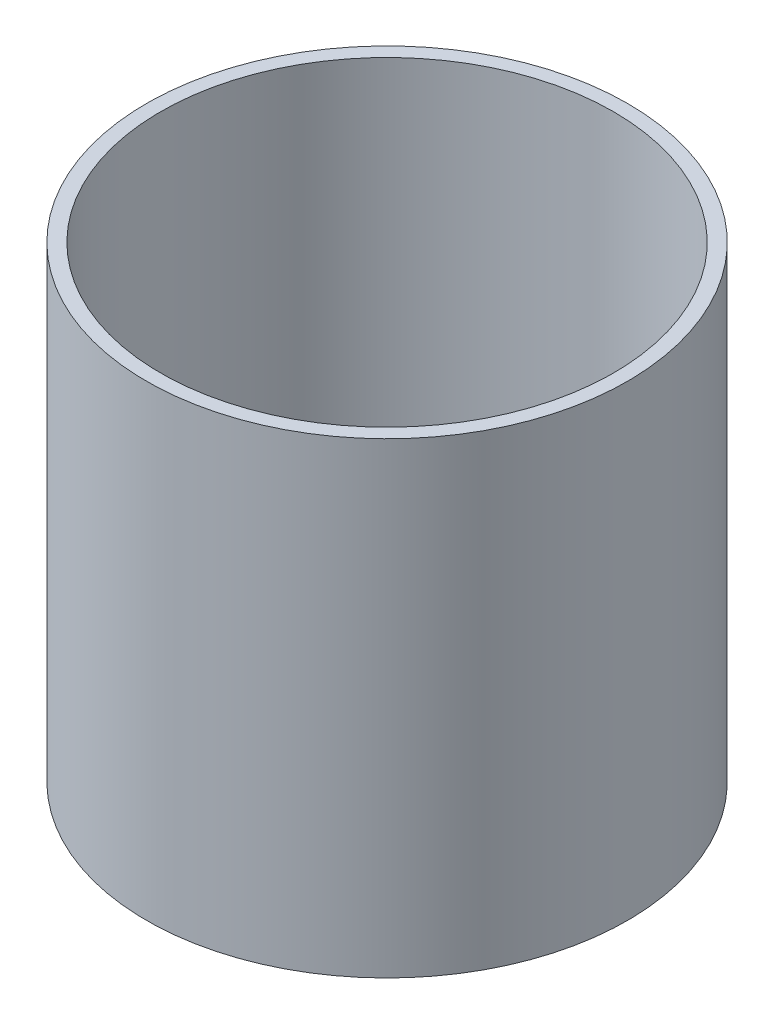
from build123d import *

# Parameters (mm, degrees)
CUT_EXTRUDE2_REACH = 206.145
MOTOR_HOLE_R       = 12.5


with BuildPart() as part:
    # Compartment → Revolve1 (revolve)
    with BuildSketch(Plane.XY, mode=Mode.PRIVATE) as revolve1_sk:
        Polygon((85, -80), (0, -80), (0, -75), (80, -75), (80, 85), (85, 85), align=None)
    revolve(revolve1_sk.sketch.rotate(Axis((0, 0, 0), (0, 1, 0)), 90), axis=Axis((0, 0, 0), (0, 1, 0)))

    # Motor Hole → Cut-Extrude2 (cut, up to next)
    with BuildSketch(Plane.XZ.offset(80), mode=Mode.PRIVATE) as cut_extrude2_sk1:
        with Locations(Location((0, 0, 0), (0, 0, 270))):
            Circle(MOTOR_HOLE_R)
    cut_extrude2_tool1 = extrude(cut_extrude2_sk1.sketch, amount=-CUT_EXTRUDE2_REACH, mode=Mode.PRIVATE) & part.part
    add(cut_extrude2_tool1.solids().sort_by_distance((0, -80, 0))[0], mode=Mode.SUBTRACT)


solid = part.part
